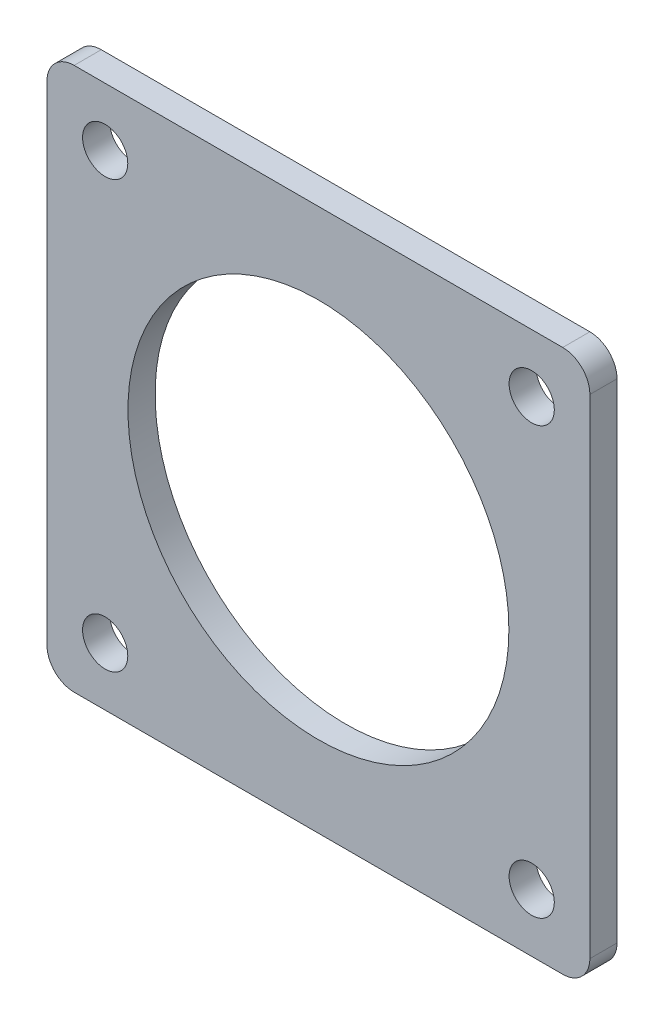
from build123d import *

# Parameters (mm, degrees)
SKETCH2_W           = 60
SKETCH2_H           = 60
SKETCH2_R           = 2.5
SKETCH2_R_2         = 21.05
BOSS_EXTRUDE1_DEPTH = 3
FILLET1_R           = 3


with BuildPart() as part:
    # Sketch2 → Boss-Extrude1 (new body)
    with BuildSketch(Plane.XY):
        with Locations((10.311464729, 39.343711654)):
            Rectangle(SKETCH2_W, SKETCH2_H)
        with Locations((33.881464729, 15.773711654)):
            Circle(SKETCH2_R, mode=Mode.SUBTRACT)
        with Locations((-13.258535271, 15.773711654)):
            Circle(SKETCH2_R, mode=Mode.SUBTRACT)
        with Locations((-13.258535271, 62.913711654)):
            Circle(SKETCH2_R, mode=Mode.SUBTRACT)
        with Locations((10.311464729, 39.343711654)):
            Circle(SKETCH2_R_2, mode=Mode.SUBTRACT)
        with Locations((33.881464729, 62.913711654)):
            Circle(SKETCH2_R, mode=Mode.SUBTRACT)
    extrude(amount=BOSS_EXTRUDE1_DEPTH)

    # Fillet1
    fillet1_edges = [part.edges().sort_by_distance(p)[0] for p in [
        (-19.688535271, 9.343711654, 1.5),
        (-19.688535271, 69.343711654, 1.5),
        (40.311464729, 69.343711654, 1.5),
        (40.311464729, 9.343711654, 1.5),
    ]]
    fillet(fillet1_edges, radius=FILLET1_R)


solid = part.part
